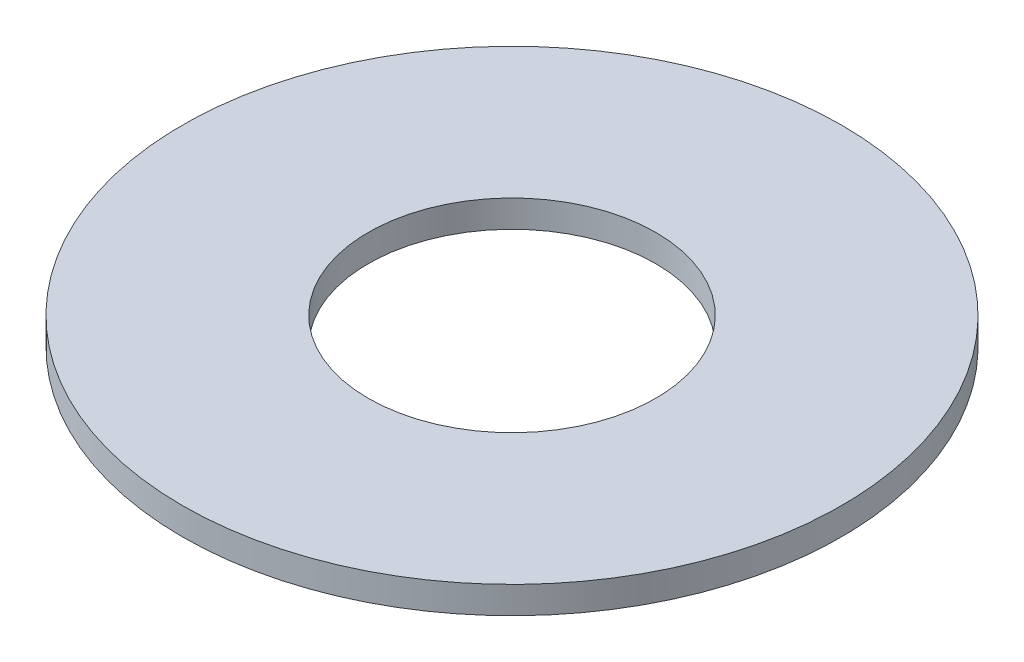
from build123d import *

# Parameters (mm, degrees)
SKETCH1_R           = 36.45
SKETCH1_R_2         = 15.9
BOSS_EXTRUDE1_DEPTH = 3


with BuildPart() as part:
    # Sketch1 → Boss-Extrude1 (new body)
    with BuildSketch(Plane(origin=(0, 0, 0), x_dir=(1, 0, 0), z_dir=(0, 1, 0))):
        with Locations(Location((0, 0, 0), (0, 0, 270))):
            Circle(SKETCH1_R)
        with Locations(Location((0, 0, 0), (0, 0, 270))):
            Circle(SKETCH1_R_2, mode=Mode.SUBTRACT)
    extrude(amount=BOSS_EXTRUDE1_DEPTH)


solid = part.part
